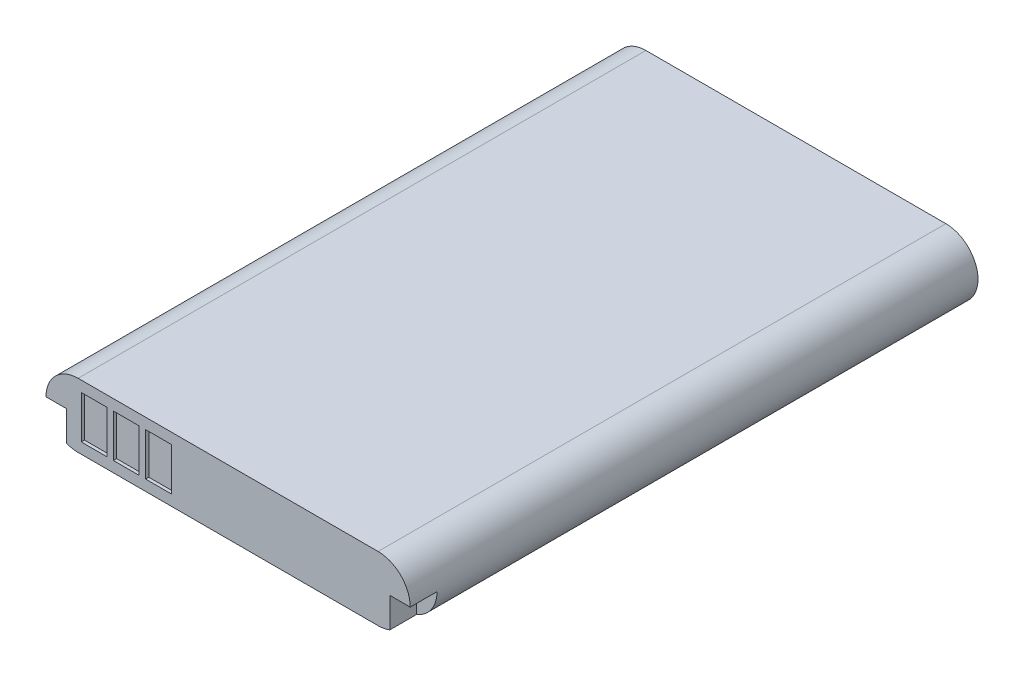
from build123d import *

# Parameters (mm, degrees)
BOSS_EXTRUDE1_DEPTH = 53
SKETCH2_W           = 2.4
SKETCH2_H           = 4
CUT_EXTRUDE1_DEPTH  = 0.3
SKETCH3_W           = 4
SKETCH3_H           = 4
CUT_EXTRUDE2_DEPTH  = 2.5


with BuildPart() as part:
    # Sketch1 → Boss-Extrude1 (new body)
    with BuildSketch(Plane.XY):
        with BuildLine():
            Line((-14, 3), (14, 3))
            ThreePointArc((14, 3), (17, 0), (14, -3))
            Line((14, -3), (-14, -3))
            ThreePointArc((-14, -3), (-17, 0), (-14, 3))
        make_face()
    extrude(amount=BOSS_EXTRUDE1_DEPTH)

    # Sketch2 → Cut-Extrude1 (cut)
    with BuildSketch(Plane.XY.offset(53)):
        with Locations((-12.5, 0)):
            Rectangle(SKETCH2_W, SKETCH2_H)
        with Locations((-9.5, 0)):
            Rectangle(SKETCH2_W, SKETCH2_H)
        with Locations((-6.5, 0)):
            Rectangle(SKETCH2_W, SKETCH2_H)
    extrude(amount=-CUT_EXTRUDE1_DEPTH, mode=Mode.SUBTRACT)

    # Sketch3 → Cut-Extrude2 (cut)
    with BuildSketch(Plane.XY.offset(53)):
        with Locations((-17.1, -2)):
            Rectangle(SKETCH3_W, SKETCH3_H)
        with Locations((17.1, -2)):
            Rectangle(SKETCH3_W, SKETCH3_H)
    extrude(amount=-CUT_EXTRUDE2_DEPTH, mode=Mode.SUBTRACT)


solid = part.part
